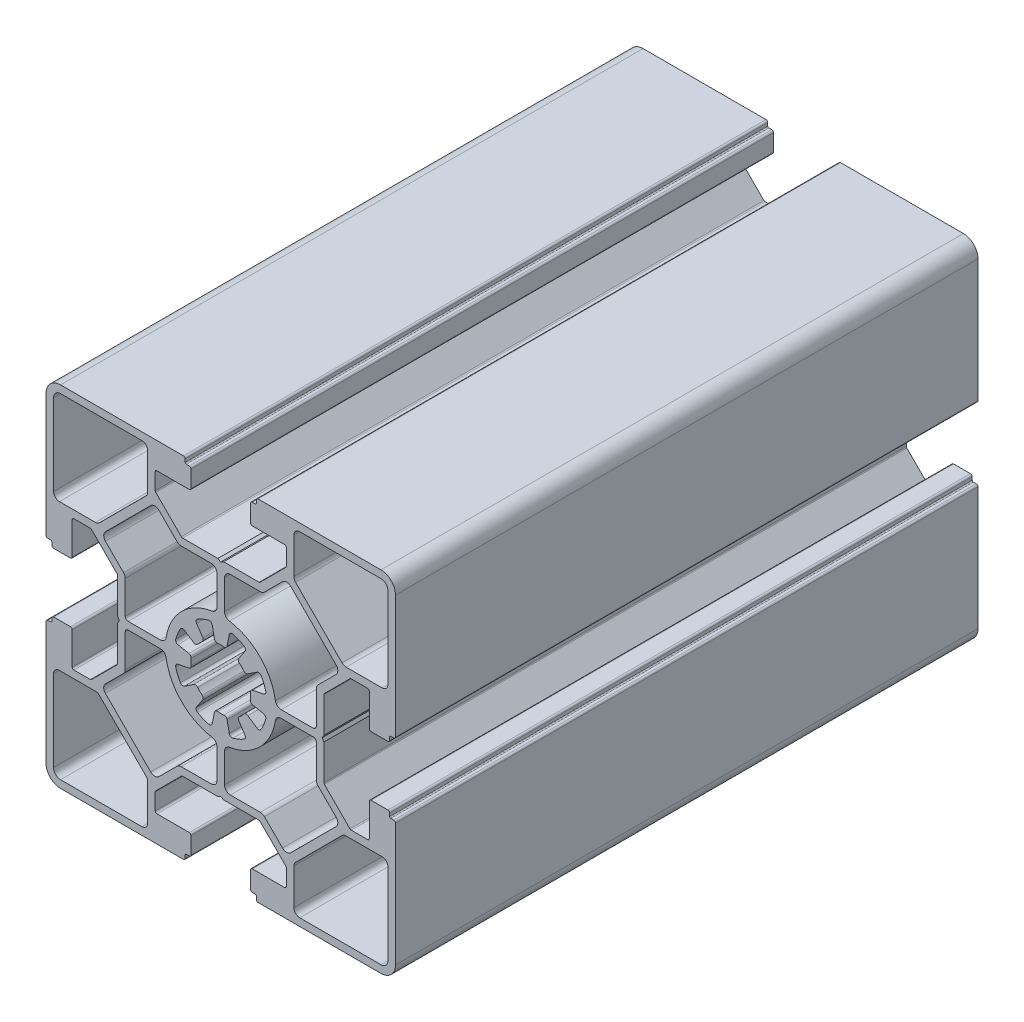
from build123d import *

# Parameters (mm, degrees)
EXTRUDE_1_DEPTH = 100


with BuildPart() as part:
    # 草图1 → 凸台-拉伸1 (new body)
    with BuildSketch(Plane.XY):
        with BuildLine():
            Line((17.7, -0.499225498), (17.411324865, 0.000774502))
            Line((17.411324865, 0.000774502), (17.7, 0.500774502))
            Line((17.7, 0.500774502), (17.7, 6.544870145))
            ThreePointArc((17.7, 6.544870145), (17.72283614, 6.659675174), (17.787867966, 6.757002179))
            Line((17.787867966, 6.757002179), (22.192997821, 11.162132034))
            ThreePointArc((22.192997821, 11.162132034), (22.290324826, 11.22716386), (22.405129855, 11.25))
            Line((22.405129855, 11.25), (25.2, 11.25))
            ThreePointArc((25.2, 11.25), (25.412132034, 11.162132034), (25.5, 10.95))
            Line((25.5, 10.95), (25.5, 5.4))
            ThreePointArc((25.5, 5.4), (25.587867966, 5.187867966), (25.8, 5.1))
            Line((25.8, 5.1), (28.7, 5.1))
            ThreePointArc((28.7, 5.1), (28.912132034, 5.187867966), (29, 5.4))
            Line((29, 5.4), (29, 5.9))
            ThreePointArc((29, 5.9), (29.058578644, 6.041421356), (29.2, 6.1))
            Line((29.2, 6.1), (29.7, 6.1))
            ThreePointArc((29.7, 6.1), (29.912132034, 6.187867966), (30, 6.4))
            Line((30, 6.4), (30, 27.5))
            ThreePointArc((30, 27.5), (29.267766953, 29.267766953), (27.5, 30))
            Line((27.5, 30), (6.4, 30))
            ThreePointArc((6.4, 30), (6.187867966, 29.912132034), (6.1, 29.7))
            Line((6.1, 29.7), (6.1, 29.2))
            ThreePointArc((6.1, 29.2), (6.041421356, 29.058578644), (5.9, 29))
            Line((5.9, 29), (5.4, 29))
            ThreePointArc((5.4, 29), (5.187867966, 28.912132034), (5.1, 28.7))
            Line((5.1, 28.7), (5.1, 25.8))
            ThreePointArc((5.1, 25.8), (5.187867966, 25.587867966), (5.4, 25.5))
            Line((5.4, 25.5), (10.95, 25.5))
            ThreePointArc((10.95, 25.5), (11.162132034, 25.412132034), (11.25, 25.2))
            Line((11.25, 25.2), (11.25, 22.405129855))
            ThreePointArc((11.25, 22.405129855), (11.22716386, 22.290324826), (11.162132034, 22.192997821))
            Line((11.162132034, 22.192997821), (6.757002179, 17.787867966))
            ThreePointArc((6.757002179, 17.787867966), (6.659675174, 17.72283614), (6.544870145, 17.7))
            Line((6.544870145, 17.7), (0.5, 17.7))
            Line((0.5, 17.7), (0, 17.411324865))
            Line((0, 17.411324865), (-0.5, 17.7))
            Line((-0.5, 17.7), (-6.544870145, 17.7))
            ThreePointArc((-6.544870145, 17.7), (-6.659675175, 17.72283614), (-6.757002179, 17.787867966))
            Line((-6.757002179, 17.787867966), (-11.162132034, 22.192997821))
            ThreePointArc((-11.162132034, 22.192997821), (-11.22716386, 22.290324826), (-11.25, 22.405129855))
            Line((-11.25, 22.405129855), (-11.25, 25.2))
            ThreePointArc((-11.25, 25.2), (-11.162132034, 25.412132034), (-10.95, 25.5))
            Line((-10.95, 25.5), (-5.4, 25.5))
            ThreePointArc((-5.4, 25.5), (-5.187867966, 25.587867966), (-5.1, 25.8))
            Line((-5.1, 25.8), (-5.1, 28.7))
            ThreePointArc((-5.1, 28.7), (-5.187867966, 28.912132034), (-5.4, 29))
            Line((-5.4, 29), (-5.9, 29))
            ThreePointArc((-5.9, 29), (-6.041421356, 29.058578644), (-6.1, 29.2))
            Line((-6.1, 29.2), (-6.1, 29.7))
            ThreePointArc((-6.1, 29.7), (-6.187867966, 29.912132034), (-6.4, 30))
            Line((-6.4, 30), (-27.5, 30))
            ThreePointArc((-27.5, 30), (-29.267766953, 29.267766953), (-30, 27.5))
            Line((-30, 27.5), (-30, 6.4))
            ThreePointArc((-30, 6.4), (-29.912132034, 6.187867966), (-29.7, 6.1))
            Line((-29.7, 6.1), (-29.2, 6.1))
            ThreePointArc((-29.2, 6.1), (-29.058578644, 6.041421356), (-29, 5.9))
            Line((-29, 5.9), (-29, 5.4))
            ThreePointArc((-29, 5.4), (-28.912132034, 5.187867966), (-28.7, 5.1))
            Line((-28.7, 5.1), (-25.8, 5.1))
            ThreePointArc((-25.8, 5.1), (-25.587867966, 5.187867966), (-25.5, 5.4))
            Line((-25.5, 5.4), (-25.5, 10.95))
            ThreePointArc((-25.5, 10.95), (-25.412132034, 11.162132034), (-25.2, 11.25))
            Line((-25.2, 11.25), (-22.405129855, 11.25))
            ThreePointArc((-22.405129855, 11.25), (-22.290324826, 11.22716386), (-22.192997821, 11.162132034))
            Line((-22.192997821, 11.162132034), (-17.787867966, 6.757002179))
            ThreePointArc((-17.787867966, 6.757002179), (-17.72283614, 6.659675174), (-17.7, 6.544870145))
            Line((-17.7, 6.544870145), (-17.7, 0.500774502))
            Line((-17.7, 0.500774502), (-17.411324865, 0.000774502))
            Line((-17.411324865, 0.000774502), (-17.7, -0.499225498))
            Line((-17.7, -0.499225498), (-17.7, -6.544870145))
            ThreePointArc((-17.7, -6.544870145), (-17.72283614, -6.659675174), (-17.787867966, -6.757002179))
            Line((-17.787867966, -6.757002179), (-22.192997821, -11.162132034))
            ThreePointArc((-22.192997821, -11.162132034), (-22.290324826, -11.22716386), (-22.405129855, -11.25))
            Line((-22.405129855, -11.25), (-25.2, -11.25))
            ThreePointArc((-25.2, -11.25), (-25.412132034, -11.162132034), (-25.5, -10.95))
            Line((-25.5, -10.95), (-25.5, -5.4))
            ThreePointArc((-25.5, -5.4), (-25.587867966, -5.187867966), (-25.8, -5.1))
            Line((-25.8, -5.1), (-28.7, -5.1))
            ThreePointArc((-28.7, -5.1), (-28.912132034, -5.187867966), (-29, -5.4))
            Line((-29, -5.4), (-29, -5.9))
            ThreePointArc((-29, -5.9), (-29.058578644, -6.041421356), (-29.2, -6.1))
            Line((-29.2, -6.1), (-29.7, -6.1))
            ThreePointArc((-29.7, -6.1), (-29.912132034, -6.187867966), (-30, -6.4))
            Line((-30, -6.4), (-30, -27.5))
            ThreePointArc((-30, -27.5), (-29.267766953, -29.267766953), (-27.5, -30))
            Line((-27.5, -30), (-6.4, -30))
            ThreePointArc((-6.4, -30), (-6.187867966, -29.912132034), (-6.1, -29.7))
            Line((-6.1, -29.7), (-6.1, -29.2))
            ThreePointArc((-6.1, -29.2), (-6.041421356, -29.058578644), (-5.9, -29))
            Line((-5.9, -29), (-5.4, -29))
            ThreePointArc((-5.4, -29), (-5.187867966, -28.912132034), (-5.1, -28.7))
            Line((-5.1, -28.7), (-5.1, -25.8))
            ThreePointArc((-5.1, -25.8), (-5.187867966, -25.587867966), (-5.4, -25.5))
            Line((-5.4, -25.5), (-10.95, -25.5))
            ThreePointArc((-10.95, -25.5), (-11.162132034, -25.412132034), (-11.25, -25.2))
            Line((-11.25, -25.2), (-11.25, -22.405129855))
            ThreePointArc((-11.25, -22.405129855), (-11.22716386, -22.290324826), (-11.162132034, -22.192997821))
            Line((-11.162132034, -22.192997821), (-6.757002179, -17.787867966))
            ThreePointArc((-6.757002179, -17.787867966), (-6.659675175, -17.72283614), (-6.544870145, -17.7))
            Line((-6.544870145, -17.7), (-0.5, -17.7))
            Line((-0.5, -17.7), (0, -17.411324865))
            Line((0, -17.411324865), (0.5, -17.7))
            Line((0.5, -17.7), (6.544870145, -17.7))
            ThreePointArc((6.544870145, -17.7), (6.659675174, -17.72283614), (6.757002179, -17.787867966))
            Line((6.757002179, -17.787867966), (11.162132034, -22.192997821))
            ThreePointArc((11.162132034, -22.192997821), (11.22716386, -22.290324826), (11.25, -22.405129855))
            Line((11.25, -22.405129855), (11.25, -25.2))
            ThreePointArc((11.25, -25.2), (11.162132034, -25.412132034), (10.95, -25.5))
            Line((10.95, -25.5), (5.4, -25.5))
            ThreePointArc((5.4, -25.5), (5.187867966, -25.587867966), (5.1, -25.8))
            Line((5.1, -25.8), (5.1, -28.7))
            ThreePointArc((5.1, -28.7), (5.187867966, -28.912132034), (5.4, -29))
            Line((5.4, -29), (5.9, -29))
            ThreePointArc((5.9, -29), (6.041421356, -29.058578644), (6.1, -29.2))
            Line((6.1, -29.2), (6.1, -29.7))
            ThreePointArc((6.1, -29.7), (6.187867966, -29.912132034), (6.4, -30))
            Line((6.4, -30), (27.5, -30))
            ThreePointArc((27.5, -30), (29.267766953, -29.267766953), (30, -27.5))
            Line((30, -27.5), (30, -6.4))
            ThreePointArc((30, -6.4), (29.912132034, -6.187867966), (29.7, -6.1))
            Line((29.7, -6.1), (29.2, -6.1))
            ThreePointArc((29.2, -6.1), (29.058578644, -6.041421356), (29, -5.9))
            Line((29, -5.9), (29, -5.4))
            ThreePointArc((29, -5.4), (28.912132034, -5.187867966), (28.7, -5.1))
            Line((28.7, -5.1), (25.8, -5.1))
            ThreePointArc((25.8, -5.1), (25.587867966, -5.187867966), (25.5, -5.4))
            Line((25.5, -5.4), (25.5, -10.95))
            ThreePointArc((25.5, -10.95), (25.412132034, -11.162132034), (25.2, -11.25))
            Line((25.2, -11.25), (22.405129855, -11.25))
            ThreePointArc((22.405129855, -11.25), (22.290324826, -11.22716386), (22.192997821, -11.162132034))
            Line((22.192997821, -11.162132034), (17.787867966, -6.757002179))
            ThreePointArc((17.787867966, -6.757002179), (17.72283614, -6.659675174), (17.7, -6.544870145))
            Line((17.7, -6.544870145), (17.7, -0.499225498))
        make_face()
        with BuildLine():
            Line((-16.4, 1.15), (-16.4, 6.793398282))
            ThreePointArc((-16.4, 6.793398282), (-16.476120468, 7.176081715), (-16.692893219, 7.500505064))
            Line((-16.692893219, 7.500505064), (-19.798989883, 10.606601723))
            ThreePointArc((-19.798989883, 10.606601723), (-20.091883102, 11.313708505), (-19.798989882, 12.020815286))
            Line((-19.798989882, 12.020815286), (-12.020815267, 19.798989865))
            ThreePointArc((-12.020815267, 19.798989865), (-11.313708486, 20.091883082), (-10.606601706, 19.798989864))
            Line((-10.606601706, 19.798989864), (-7.500505064, 16.692893219))
            ThreePointArc((-7.500505064, 16.692893219), (-7.176081715, 16.476120468), (-6.793398282, 16.4))
            Line((-6.793398282, 16.4), (-1.65, 16.4))
            ThreePointArc((-1.65, 16.4), (-0.942893219, 16.107106781), (-0.65, 15.4))
            Line((-0.65, 15.4), (-0.65, 10.36954676))
            ThreePointArc((-0.65, 10.36954676), (-0.889361171, 9.720371459), (-1.492857143, 9.381970878))
            ThreePointArc((-1.492857143, 9.381970878), (-6.717514421, 6.717514421), (-9.381970878, 1.492857143))
            ThreePointArc((-9.381970878, 1.492857143), (-9.720371459, 0.889361171), (-10.36954676, 0.65))
            Line((-10.36954676, 0.65), (-15.9, 0.65))
            ThreePointArc((-15.9, 0.65), (-16.253553391, 0.796446609), (-16.4, 1.15))
        make_face(mode=Mode.SUBTRACT)
        with BuildLine():
            Line((21.522496347, 12.55), (27.7, 12.55))
            ThreePointArc((27.7, 12.55), (28.407106781, 12.842893219), (28.7, 13.55))
            Line((28.7, 13.55), (28.7, 27.5))
            ThreePointArc((28.7, 27.5), (28.348528137, 28.348528137), (27.5, 28.7))
            Line((27.5, 28.7), (13.55, 28.7))
            ThreePointArc((13.55, 28.7), (12.842893219, 28.407106781), (12.55, 27.7))
            Line((12.55, 27.7), (12.55, 21.522496347))
            ThreePointArc((12.55, 21.522496347), (12.626120468, 21.139812914), (12.842893219, 20.815389566))
            Line((12.842893219, 20.815389566), (20.815389566, 12.842893219))
            ThreePointArc((20.815389566, 12.842893219), (21.139812915, 12.626120467), (21.522496347, 12.55))
        make_face(mode=Mode.SUBTRACT)
        with BuildLine():
            Line((16.4, 6.793398282), (16.4, 1.15))
            ThreePointArc((16.4, 1.15), (16.253553391, 0.796446609), (15.9, 0.65))
            Line((15.9, 0.65), (10.36954676, 0.65))
            ThreePointArc((10.36954676, 0.65), (9.720371459, 0.889361171), (9.381970878, 1.492857143))
            ThreePointArc((9.381970878, 1.492857143), (6.717514421, 6.717514421), (1.492857143, 9.381970878))
            ThreePointArc((1.492857143, 9.381970878), (0.889361171, 9.720371459), (0.65, 10.36954676))
            Line((0.65, 10.36954676), (0.65, 15.4))
            ThreePointArc((0.65, 15.4), (0.942893219, 16.107106781), (1.65, 16.4))
            Line((1.65, 16.4), (6.793398282, 16.4))
            ThreePointArc((6.793398282, 16.4), (7.176081715, 16.476120468), (7.500505064, 16.692893219))
            Line((7.500505064, 16.692893219), (10.606601706, 19.798989864))
            ThreePointArc((10.606601706, 19.798989864), (11.313708486, 20.091883082), (12.020815267, 19.798989865))
            Line((12.020815267, 19.798989865), (19.798989881, 12.020815287))
            ThreePointArc((19.798989881, 12.020815287), (20.091883102, 11.313708505), (19.798989882, 10.606601722))
            Line((19.798989882, 10.606601722), (16.692893219, 7.500505064))
            ThreePointArc((16.692893219, 7.500505064), (16.476120468, 7.176081715), (16.4, 6.793398282))
        make_face(mode=Mode.SUBTRACT)
        with BuildLine():
            Line((16.4, -1.15), (16.4, -6.793398282))
            ThreePointArc((16.4, -6.793398282), (16.476120468, -7.176081715), (16.692893219, -7.500505064))
            Line((16.692893219, -7.500505064), (19.798989883, -10.606601723))
            ThreePointArc((19.798989883, -10.606601723), (20.091883102, -11.313708505), (19.798989882, -12.020815286))
            Line((19.798989882, -12.020815286), (12.020815267, -19.798989865))
            ThreePointArc((12.020815267, -19.798989865), (11.313708486, -20.091883082), (10.606601706, -19.798989864))
            Line((10.606601706, -19.798989864), (7.500505064, -16.692893219))
            ThreePointArc((7.500505064, -16.692893219), (7.176081715, -16.476120468), (6.793398282, -16.4))
            Line((6.793398282, -16.4), (1.65, -16.4))
            ThreePointArc((1.65, -16.4), (0.942893219, -16.107106781), (0.65, -15.4))
            Line((0.65, -15.4), (0.65, -10.36954676))
            ThreePointArc((0.65, -10.36954676), (0.889361171, -9.720371459), (1.492857143, -9.381970878))
            ThreePointArc((1.492857143, -9.381970878), (6.717514421, -6.717514421), (9.381970878, -1.492857143))
            ThreePointArc((9.381970878, -1.492857143), (9.720371459, -0.889361171), (10.36954676, -0.65))
            Line((10.36954676, -0.65), (15.9, -0.65))
            ThreePointArc((15.9, -0.65), (16.253553391, -0.796446609), (16.4, -1.15))
        make_face(mode=Mode.SUBTRACT)
        with BuildLine():
            Line((4.157506932, -6.222148833), (3.098767369, -4.637633102))
            ThreePointArc((3.098767369, -4.637633102), (3.020240381, -4.284314692), (3.200707338, -3.970575844))
            ThreePointArc((3.200707338, -3.970575844), (3.606244584, -3.606244584), (3.970575844, -3.200707338))
            ThreePointArc((3.970575844, -3.200707338), (4.284314692, -3.020240381), (4.637633102, -3.098767369))
            Line((4.637633102, -3.098767369), (6.222148833, -4.157506932))
            ThreePointArc((6.222148833, -4.157506932), (6.613780364, -4.228638632), (6.93326288, -3.991223601))
            ThreePointArc((6.93326288, -3.991223601), (7.39103626, -3.061467459), (7.724778472, -2.080335924))
            ThreePointArc((7.724778472, -2.080335924), (7.666747996, -1.686549893), (7.339524979, -1.459922289))
            Line((7.339524979, -1.459922289), (5.470461235, -1.088142395))
            ThreePointArc((5.470461235, -1.088142395), (5.165100425, -0.893835517), (5.070862968, -0.544379241))
            ThreePointArc((5.070862968, -0.544379241), (5.1, 0), (5.070862968, 0.544379241))
            ThreePointArc((5.070862968, 0.544379241), (5.165100425, 0.893835517), (5.470461235, 1.088142395))
            Line((5.470461235, 1.088142395), (7.339524979, 1.459922289))
            ThreePointArc((7.339524979, 1.459922289), (7.666747996, 1.686549893), (7.724778472, 2.080335924))
            ThreePointArc((7.724778472, 2.080335924), (7.39103626, 3.061467459), (6.93326288, 3.991223601))
            ThreePointArc((6.93326288, 3.991223601), (6.613780364, 4.228638632), (6.222148833, 4.157506933))
            Line((6.222148833, 4.157506933), (4.637633102, 3.098767369))
            ThreePointArc((4.637633102, 3.098767369), (4.284314692, 3.020240381), (3.970575844, 3.200707338))
            ThreePointArc((3.970575844, 3.200707338), (3.606244584, 3.606244584), (3.200707338, 3.970575844))
            ThreePointArc((3.200707338, 3.970575844), (3.020240381, 4.284314692), (3.098767369, 4.637633102))
            Line((3.098767369, 4.637633102), (4.157506932, 6.222148834))
            ThreePointArc((4.157506932, 6.222148834), (4.228638632, 6.613780364), (3.991223601, 6.93326288))
            ThreePointArc((3.991223601, 6.93326288), (3.061467459, 7.39103626), (2.080335924, 7.724778472))
            ThreePointArc((2.080335924, 7.724778472), (1.686549893, 7.666747996), (1.459922289, 7.339524979))
            Line((1.459922289, 7.339524979), (1.088142395, 5.470461235))
            ThreePointArc((1.088142395, 5.470461235), (0.893835517, 5.165100425), (0.544379241, 5.070862968))
            ThreePointArc((0.544379241, 5.070862968), (0, 5.1), (-0.544379241, 5.070862968))
            ThreePointArc((-0.544379241, 5.070862968), (-0.893835517, 5.165100425), (-1.088142395, 5.470461235))
            Line((-1.088142395, 5.470461235), (-1.459922289, 7.339524979))
            ThreePointArc((-1.459922289, 7.339524979), (-1.686549893, 7.666747996), (-2.080335924, 7.724778472))
            ThreePointArc((-2.080335924, 7.724778472), (-3.061467459, 7.39103626), (-3.991223601, 6.93326288))
            ThreePointArc((-3.991223601, 6.93326288), (-4.228638632, 6.613780364), (-4.157506933, 6.222148834))
            Line((-4.157506933, 6.222148834), (-3.098767369, 4.637633102))
            ThreePointArc((-3.098767369, 4.637633102), (-3.020240381, 4.284314692), (-3.200707338, 3.970575844))
            ThreePointArc((-3.200707338, 3.970575844), (-3.606244584, 3.606244584), (-3.970575844, 3.200707338))
            ThreePointArc((-3.970575844, 3.200707338), (-4.284314692, 3.020240381), (-4.637633102, 3.098767369))
            Line((-4.637633102, 3.098767369), (-6.222148834, 4.157506933))
            ThreePointArc((-6.222148834, 4.157506933), (-6.613780364, 4.228638632), (-6.93326288, 3.991223601))
            ThreePointArc((-6.93326288, 3.991223601), (-7.39103626, 3.061467459), (-7.724778472, 2.080335924))
            ThreePointArc((-7.724778472, 2.080335924), (-7.666747996, 1.686549893), (-7.339524979, 1.459922289))
            Line((-7.339524979, 1.459922289), (-5.470461235, 1.088142395))
            ThreePointArc((-5.470461235, 1.088142395), (-5.165100425, 0.893835517), (-5.070862968, 0.544379241))
            ThreePointArc((-5.070862968, 0.544379241), (-5.1, 0), (-5.070862968, -0.544379241))
            ThreePointArc((-5.070862968, -0.544379241), (-5.165100425, -0.893835517), (-5.470461235, -1.088142395))
            Line((-5.470461235, -1.088142395), (-7.339524979, -1.459922289))
            ThreePointArc((-7.339524979, -1.459922289), (-7.666747996, -1.686549893), (-7.724778472, -2.080335924))
            ThreePointArc((-7.724778472, -2.080335924), (-7.39103626, -3.061467459), (-6.93326288, -3.991223601))
            ThreePointArc((-6.93326288, -3.991223601), (-6.613780364, -4.228638632), (-6.222148834, -4.157506932))
            Line((-6.222148834, -4.157506932), (-4.637633102, -3.098767369))
            ThreePointArc((-4.637633102, -3.098767369), (-4.284314692, -3.020240381), (-3.970575844, -3.200707338))
            ThreePointArc((-3.970575844, -3.200707338), (-3.606244584, -3.606244584), (-3.200707338, -3.970575844))
            ThreePointArc((-3.200707338, -3.970575844), (-3.020240381, -4.284314692), (-3.098767369, -4.637633102))
            Line((-3.098767369, -4.637633102), (-4.157506933, -6.222148833))
            ThreePointArc((-4.157506933, -6.222148833), (-4.228638632, -6.613780364), (-3.991223601, -6.93326288))
            ThreePointArc((-3.991223601, -6.93326288), (-3.061467459, -7.39103626), (-2.080335924, -7.724778472))
            ThreePointArc((-2.080335924, -7.724778472), (-1.686549893, -7.666747996), (-1.459922289, -7.339524979))
            Line((-1.459922289, -7.339524979), (-1.088142395, -5.470461235))
            ThreePointArc((-1.088142395, -5.470461235), (-0.893835517, -5.165100425), (-0.544379241, -5.070862968))
            ThreePointArc((-0.544379241, -5.070862968), (0, -5.1), (0.544379241, -5.070862968))
            ThreePointArc((0.544379241, -5.070862968), (0.893835517, -5.165100425), (1.088142395, -5.470461235))
            Line((1.088142395, -5.470461235), (1.459922289, -7.339524979))
            ThreePointArc((1.459922289, -7.339524979), (1.686549893, -7.666747996), (2.080335924, -7.724778472))
            ThreePointArc((2.080335924, -7.724778472), (3.061467459, -7.39103626), (3.991223601, -6.93326288))
            ThreePointArc((3.991223601, -6.93326288), (4.228638632, -6.613780364), (4.157506932, -6.222148833))
        make_face(mode=Mode.SUBTRACT)
        with BuildLine():
            Line((-21.522496347, -12.55), (-27.7, -12.55))
            ThreePointArc((-27.7, -12.55), (-28.407106781, -12.842893219), (-28.7, -13.55))
            Line((-28.7, -13.55), (-28.7, -27.5))
            ThreePointArc((-28.7, -27.5), (-28.348528137, -28.348528137), (-27.5, -28.7))
            Line((-27.5, -28.7), (-13.55, -28.7))
            ThreePointArc((-13.55, -28.7), (-12.842893219, -28.407106781), (-12.55, -27.7))
            Line((-12.55, -27.7), (-12.55, -21.522496347))
            ThreePointArc((-12.55, -21.522496347), (-12.626120468, -21.139812914), (-12.842893219, -20.815389566))
            Line((-12.842893219, -20.815389566), (-20.815389566, -12.842893219))
            ThreePointArc((-20.815389566, -12.842893219), (-21.139812915, -12.626120467), (-21.522496347, -12.55))
        make_face(mode=Mode.SUBTRACT)
        with BuildLine():
            Line((-16.4, -6.793398282), (-16.4, -1.15))
            ThreePointArc((-16.4, -1.15), (-16.253553391, -0.796446609), (-15.9, -0.65))
            Line((-15.9, -0.65), (-10.36954676, -0.65))
            ThreePointArc((-10.36954676, -0.65), (-9.720371459, -0.889361171), (-9.381970878, -1.492857143))
            ThreePointArc((-9.381970878, -1.492857143), (-6.717514421, -6.717514421), (-1.492857143, -9.381970878))
            ThreePointArc((-1.492857143, -9.381970878), (-0.889361171, -9.720371459), (-0.65, -10.36954676))
            Line((-0.65, -10.36954676), (-0.65, -15.4))
            ThreePointArc((-0.65, -15.4), (-0.942893219, -16.107106781), (-1.65, -16.4))
            Line((-1.65, -16.4), (-6.793398282, -16.4))
            ThreePointArc((-6.793398282, -16.4), (-7.176081715, -16.476120468), (-7.500505064, -16.692893219))
            Line((-7.500505064, -16.692893219), (-10.606601706, -19.798989864))
            ThreePointArc((-10.606601706, -19.798989864), (-11.313708486, -20.091883082), (-12.020815267, -19.798989865))
            Line((-12.020815267, -19.798989865), (-19.798989881, -12.020815287))
            ThreePointArc((-19.798989881, -12.020815287), (-20.091883102, -11.313708505), (-19.798989882, -10.606601722))
            Line((-19.798989882, -10.606601722), (-16.692893219, -7.500505064))
            ThreePointArc((-16.692893219, -7.500505064), (-16.476120468, -7.176081715), (-16.4, -6.793398282))
        make_face(mode=Mode.SUBTRACT)
        with BuildLine():
            Line((-20.815389566, 12.842893219), (-12.842893219, 20.815389566))
            ThreePointArc((-12.842893219, 20.815389566), (-12.626120468, 21.139812914), (-12.55, 21.522496347))
            Line((-12.55, 21.522496347), (-12.55, 27.7))
            ThreePointArc((-12.55, 27.7), (-12.842893219, 28.407106781), (-13.55, 28.7))
            Line((-13.55, 28.7), (-27.5, 28.7))
            ThreePointArc((-27.5, 28.7), (-28.348528137, 28.348528137), (-28.7, 27.5))
            Line((-28.7, 27.5), (-28.7, 13.55))
            ThreePointArc((-28.7, 13.55), (-28.407106781, 12.842893219), (-27.7, 12.55))
            Line((-27.7, 12.55), (-21.522496347, 12.55))
            ThreePointArc((-21.522496347, 12.55), (-21.139812915, 12.626120467), (-20.815389566, 12.842893219))
        make_face(mode=Mode.SUBTRACT)
        with BuildLine():
            Line((20.815389566, -12.842893219), (12.842893219, -20.815389566))
            ThreePointArc((12.842893219, -20.815389566), (12.626120468, -21.139812914), (12.55, -21.522496347))
            Line((12.55, -21.522496347), (12.55, -27.7))
            ThreePointArc((12.55, -27.7), (12.842893219, -28.407106781), (13.55, -28.7))
            Line((13.55, -28.7), (27.5, -28.7))
            ThreePointArc((27.5, -28.7), (28.348528137, -28.348528137), (28.7, -27.5))
            Line((28.7, -27.5), (28.7, -13.55))
            ThreePointArc((28.7, -13.55), (28.407106781, -12.842893219), (27.7, -12.55))
            Line((27.7, -12.55), (21.522496347, -12.55))
            ThreePointArc((21.522496347, -12.55), (21.139812915, -12.626120467), (20.815389566, -12.842893219))
        make_face(mode=Mode.SUBTRACT)
    extrude(amount=EXTRUDE_1_DEPTH)


solid = part.part
